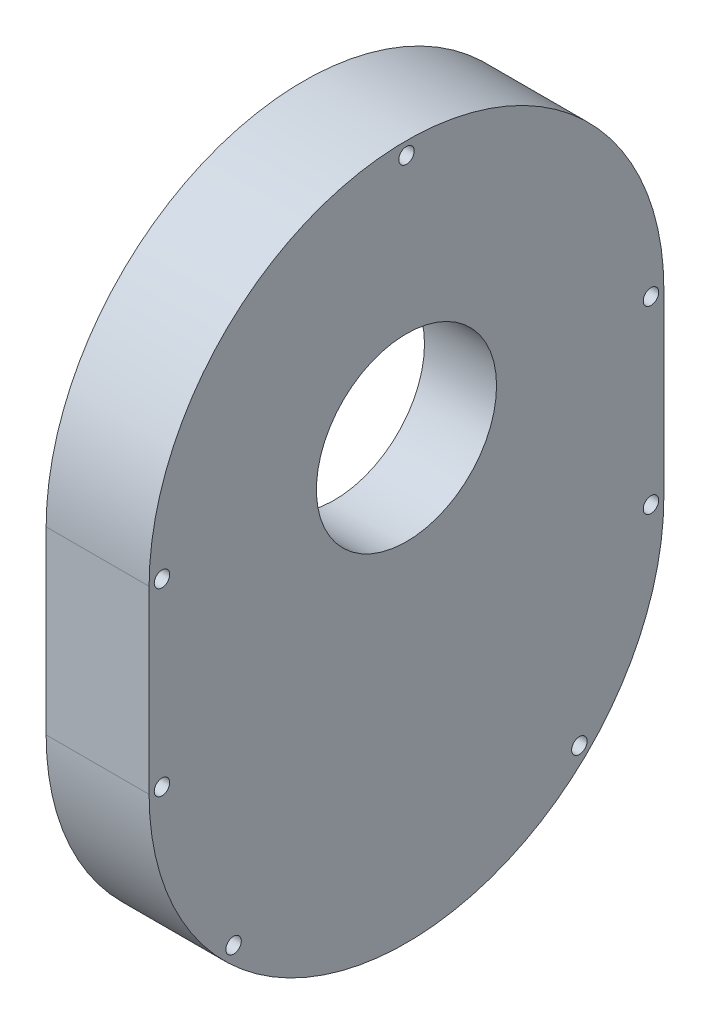
from build123d import *

# Parameters (mm, degrees)
CROQUIS1_R              = 17.5
SALIENTE_EXTRUIR1_DEPTH = 20
CROQUIS2_R              = 30
CORTAR_EXTRUIR1_DEPTH   = 6
CROQUIS3_R              = 10
CORTAR_EXTRUIR2_DEPTH   = 10
CROQUIS4_R              = 1.5
CORTAR_EXTRUIR3_DEPTH   = 101.623059057


with BuildPart() as part:
    # Croquis1 → Saliente-Extruir1 (new body)
    with BuildSketch(Plane(origin=(0, 0, 0), x_dir=(0, 0, -1), z_dir=(1, 0, 0))):
        with BuildLine():
            Line((-50, 35), (-50, 0))
            ThreePointArc((-50, 0), (0, -50), (50, 0))
            Line((50, 0), (50, 35))
            ThreePointArc((50, 35), (0, 85), (-50, 35))
        make_face()
        with Locations((0, 35)):
            Circle(CROQUIS1_R, mode=Mode.SUBTRACT)
    extrude(amount=SALIENTE_EXTRUIR1_DEPTH)

    # Croquis2 → Cortar-Extruir1 (cut)
    with BuildSketch(Plane(origin=(0, 0, 0), x_dir=(0, 0, -1), z_dir=(1, 0, 0))):
        with Locations((0, 35)):
            Circle(CROQUIS2_R)
    extrude(amount=CORTAR_EXTRUIR1_DEPTH, mode=Mode.SUBTRACT)

    # Croquis3 → Cortar-Extruir2 (cut)
    with BuildSketch(Plane(origin=(0, -50, 0), x_dir=(1, 0, 0), z_dir=(0, 1, 0))):
        with Locations((-7.5, 0)):
            Circle(CROQUIS3_R)
    extrude(amount=CORTAR_EXTRUIR2_DEPTH, mode=Mode.SUBTRACT)

    # Croquis4 → Cortar-Extruir3 (cut, through all)
    with BuildSketch(Plane.ZY):
        with Locations((0, 82.5)):
            Circle(CROQUIS4_R)
        with Locations((47.5, 35)):
            Circle(CROQUIS4_R)
        with Locations((-47.5, 35)):
            Circle(CROQUIS4_R)
        with Locations((-47.5, 0)):
            Circle(CROQUIS4_R)
        with Locations((47.5, 0)):
            Circle(CROQUIS4_R)
        with Locations((33.587572106, -33.587572106)):
            Circle(CROQUIS4_R)
        with Locations((-33.587572106, -33.587572106)):
            Circle(CROQUIS4_R)
    extrude(amount=-CORTAR_EXTRUIR3_DEPTH, mode=Mode.SUBTRACT)


solid = part.part
